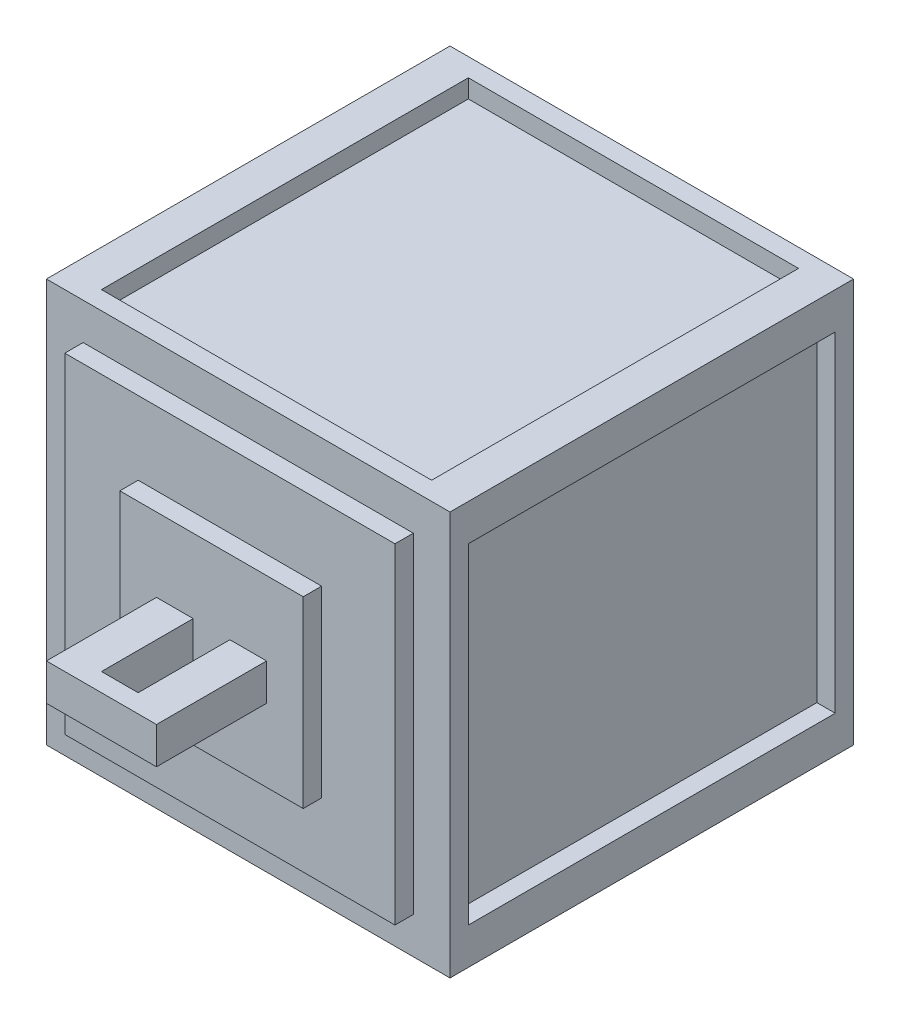
from build123d import *

# Parameters (mm, degrees)
SALIENTE_EXTRUIR2_DEPTH = 100
CROQUIS2_W              = 110
CROQUIS2_H              = 110
SALIENTE_EXTRUIR3_DEPTH = 5
CROQUIS3_W              = 110
CROQUIS3_H              = 110
SALIENTE_EXTRUIR4_DEPTH = 5
CROQUIS4_W              = 90
CROQUIS4_H              = 90
SALIENTE_EXTRUIR5_DEPTH = 5
CROQUIS5_W              = 50
CROQUIS5_H              = 50
SALIENTE_EXTRUIR6_DEPTH = 5
CROQUIS6_W              = 10
CROQUIS6_H              = 10
SALIENTE_EXTRUIR7_DEPTH = 25
CROQUIS7_W              = 30
CROQUIS7_H              = 10
SALIENTE_EXTRUIR8_DEPTH = 5


with BuildPart() as part:
    # Croquis1 → Saliente-Extruir2 (new body)
    with BuildSketch(Plane.XY):
        Polygon((-45, 50), (45, 50), (45, 55), (55, 55), (55, 45), (50, 45), (50, -45), (55, -45), (55, -55), (45, -55), (45, -50), (-45, -50), (-45, -55), (-55, -55), (-55, -45), (-50, -45), (-50, 45), (-55, 45), (-55, 55), (-45, 55), align=None)
    extrude(amount=SALIENTE_EXTRUIR2_DEPTH)

    # Croquis2 → Saliente-Extruir3 (add)
    with BuildSketch(Plane.XY.offset(100)):
        Rectangle(CROQUIS2_W, CROQUIS2_H)
    extrude(amount=SALIENTE_EXTRUIR3_DEPTH)

    # Croquis3 → Saliente-Extruir4 (add)
    with BuildSketch(Plane(origin=(0, 0, 0), x_dir=(-1, 0, 0), z_dir=(0, 0, -1))):
        Rectangle(CROQUIS3_W, CROQUIS3_H)
    extrude(amount=SALIENTE_EXTRUIR4_DEPTH)

    # Croquis4 → Saliente-Extruir5 (add)
    with BuildSketch(Plane.XY.offset(105)):
        Rectangle(CROQUIS4_W, CROQUIS4_H)
    extrude(amount=SALIENTE_EXTRUIR5_DEPTH)

    # Croquis5 → Saliente-Extruir6 (add)
    with BuildSketch(Plane.XY.offset(110)):
        Rectangle(CROQUIS5_W, CROQUIS5_H)
    extrude(amount=SALIENTE_EXTRUIR6_DEPTH)

    # Croquis6 → Saliente-Extruir7 (add)
    with BuildSketch(Plane.XY.offset(115)):
        with Locations((-10, -0.15538451)):
            Rectangle(CROQUIS6_W, CROQUIS6_H)
        with Locations((10, -0.15538451)):
            Rectangle(CROQUIS6_W, CROQUIS6_H)
    extrude(amount=SALIENTE_EXTRUIR7_DEPTH)

    # Croquis7 → Saliente-Extruir8 (add)
    with BuildSketch(Plane.XY.offset(140)):
        with Locations((0, -0.15538451)):
            Rectangle(CROQUIS7_W, CROQUIS7_H)
    extrude(amount=SALIENTE_EXTRUIR8_DEPTH)


solid = part.part
